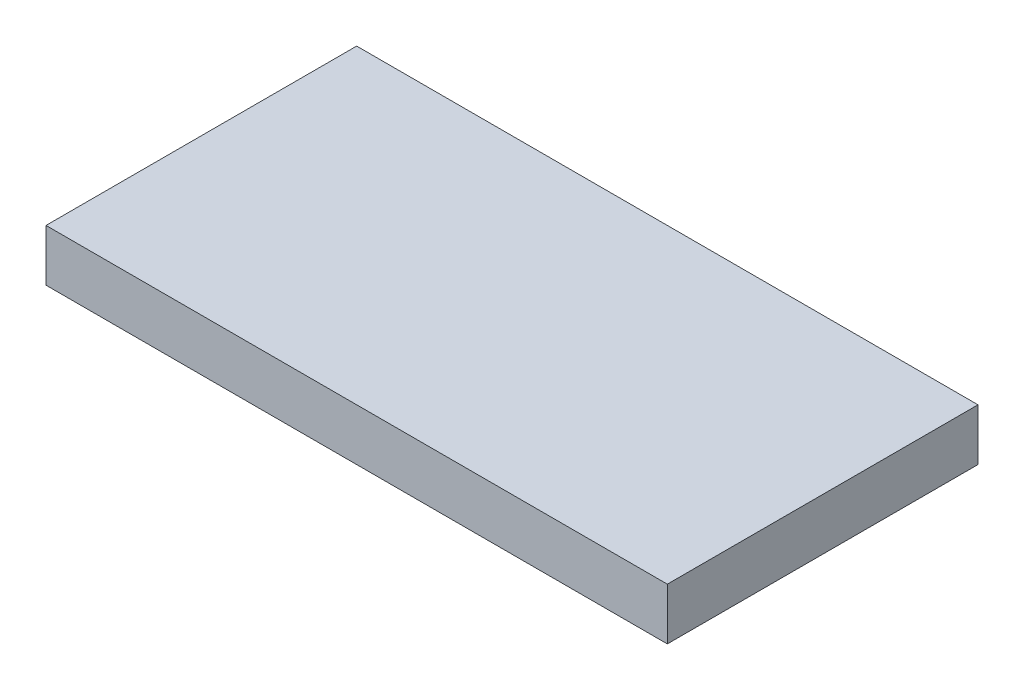
from build123d import *

# Parameters (mm, degrees)
SKETCH1_W           = 60
SKETCH1_H           = 30
BOSS_EXTRUDE1_DEPTH = 2.5


with BuildPart() as part:
    # Sketch1 → Boss-Extrude1 (new, symmetric)
    with BuildSketch(Plane(origin=(0, 0, 0), x_dir=(1, 0, 0), z_dir=(0, 1, 0))):
        Rectangle(SKETCH1_W, SKETCH1_H)
    extrude(amount=BOSS_EXTRUDE1_DEPTH, both=True)


solid = part.part
